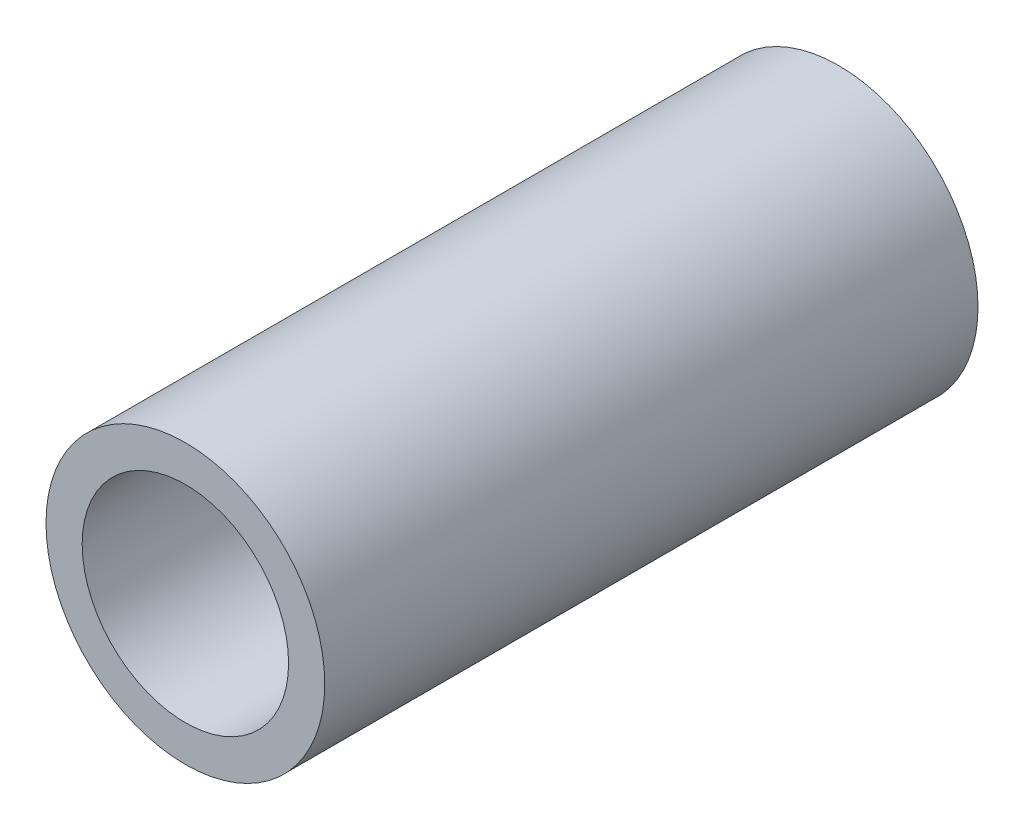
from build123d import *

# Parameters (mm, degrees)
SKETCH1_R           = 10.668
SKETCH1_R_2         = 7.8994
EXTRUDE_THIN1_DEPTH = 25


with BuildPart() as part:
    # Sketch1 → Extrude-Thin1 (new, symmetric)
    with BuildSketch(Plane.XY):
        Circle(SKETCH1_R)
        Circle(SKETCH1_R_2, mode=Mode.SUBTRACT)
    extrude(amount=EXTRUDE_THIN1_DEPTH, both=True)


solid = part.part
